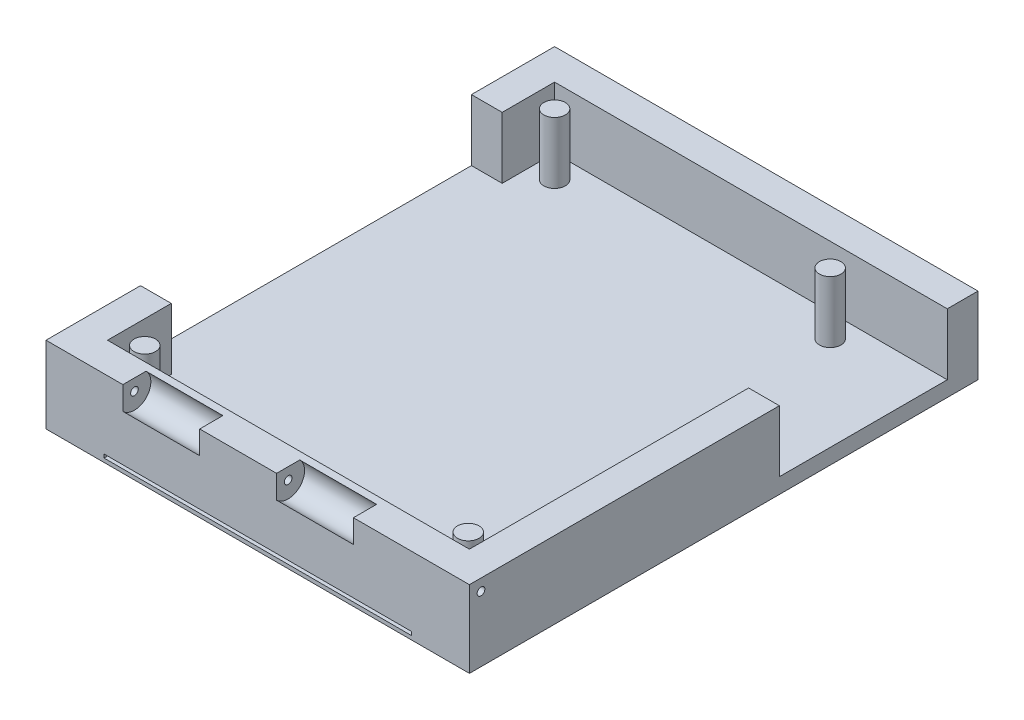
from build123d import *

# Parameters (mm, degrees)
SKETCH1_W           = 47.09
SKETCH1_H           = 58.17
BOSS_EXTRUDE1_DEPTH = 2
SKETCH2_R           = 1.4
BOSS_EXTRUDE2_DEPTH = 8
BOSS_EXTRUDE3_DEPTH = 10
SKETCH6_W           = 4.055357108
SKETCH6_H           = 43.053811849
SKETCH6_W_2         = 4
SKETCH6_H_2         = 21.843851608
CUT_EXTRUDE2_DEPTH  = 8
SKETCH8_R           = 0.5
CUT_EXTRUDE3_DEPTH  = 84.666104248
SKETCH10_R          = 2.134407384
CUT_EXTRUDE4_DEPTH  = 10
SKETCH11_R          = 2.134407384
CUT_EXTRUDE5_DEPTH  = 10
BOSS_EXTRUDE4_DEPTH = 2
SKETCH13_W          = 39.99
SKETCH13_H          = 0.463806664
CUT_EXTRUDE6_DEPTH  = 85.194162505


with BuildPart() as part:
    # Sketch1 → Boss-Extrude1 (new body)
    with BuildSketch(Plane(origin=(0, 0, 0), x_dir=(1, 0, 0), z_dir=(0, 1, 0))):
        with Locations((23.545, -29.085)):
            Rectangle(SKETCH1_W, SKETCH1_H)
    extrude(amount=BOSS_EXTRUDE1_DEPTH)

    # Sketch2 → Boss-Extrude2 (add)
    with BuildSketch(Plane(origin=(0, 2, 0), x_dir=(1, 0, 0), z_dir=(0, 1, 0))):
        with Locations(Location((38.86, -3, 0), (0, 0, 90))):
            Circle(SKETCH2_R)
        with Locations(Location((45.09, -56.32, 0), (0, 0, 90))):
            Circle(SKETCH2_R)
        with Locations(Location((3, -56.32, 0), (0, 0, 90))):
            Circle(SKETCH2_R)
        with Locations(Location((3, -3, 0), (0, 0, 90))):
            Circle(SKETCH2_R)
    extrude(amount=BOSS_EXTRUDE2_DEPTH)

    # Sketch3 → Boss-Extrude3 (add)
    with BuildSketch(Plane(origin=(0, 0, 0), x_dir=(1, 0, 0), z_dir=(0, 1, 0))):
        Polygon((0, -26.469922438), (0, 0), (23.66505447, 0), (23.66505447, 4), (-4, 4), (-4, -26.469922438), align=None)
        Polygon((23.66505447, 4), (23.66505447, 0), (47.09, 0), (47.09, -29.085), (51.09, -29.085), (51.09, 4), align=None)
        Polygon((47.09, -58.17), (23.66505447, -58.17), (23.66505447, -62.17), (51.09, -62.17), (51.09, -29.085), (47.09, -29.085), align=None)
        Polygon((0, -58.17), (0, -26.469922438), (-4, -26.469922438), (-4, -62.17), (23.66505447, -62.17), (23.66505447, -58.17), align=None)
    extrude(amount=BOSS_EXTRUDE3_DEPTH)

    # Sketch6 → Cut-Extrude2 (cut)
    with BuildSketch(Plane(origin=(0, 10, 0), x_dir=(1, 0, 0), z_dir=(0, 1, 0))):
        with Locations((-1.972321446, -28.345718343)):
            Rectangle(SKETCH6_W, SKETCH6_H)
        with Locations((49.09, -10.921925804)):
            Rectangle(SKETCH6_W_2, SKETCH6_H_2)
    extrude(amount=-CUT_EXTRUDE2_DEPTH, mode=Mode.SUBTRACT)

    # Sketch8 → Cut-Extrude3 (cut, through all)
    with BuildSketch(Plane(origin=(51.09, 0, 0), x_dir=(0, 0, -1), z_dir=(1, 0, 0))):
        with Locations((-60.66237095, 8.489122927)):
            Circle(SKETCH8_R)
    extrude(amount=-CUT_EXTRUDE3_DEPTH, mode=Mode.SUBTRACT)

    # Sketch10 → Cut-Extrude4 (cut)
    with BuildSketch(Plane(origin=(6, 10, 62.17), x_dir=(0, 0, -1), z_dir=(1, 0, 0))):
        with Locations((1.50762905, -1.510877073)):
            Circle(SKETCH10_R)
    extrude(amount=CUT_EXTRUDE4_DEPTH, mode=Mode.SUBTRACT)

    # Sketch11 → Cut-Extrude5 (cut)
    with BuildSketch(Plane(origin=(26, 10, 62.17), x_dir=(0, 0, -1), z_dir=(1, 0, 0))):
        with Locations((1.50762905, -1.510877073)):
            Circle(SKETCH11_R)
    extrude(amount=CUT_EXTRUDE5_DEPTH, mode=Mode.SUBTRACT)

    # Sketch12 → Boss-Extrude4 (add)
    with BuildSketch(Plane(origin=(0, 0, -4), x_dir=(-1, 0, 0), z_dir=(0, 0, -1))):
        Polygon((-23.54, 7.513197032), (-28.54, 7.513197032), (-28.54, 6.476270602), (-18.54, 6.476270602), (-18.54, 7.513197032), align=None)
    extrude(amount=BOSS_EXTRUDE4_DEPTH)

    # Sketch13 → Cut-Extrude6 (cut, through all)
    with BuildSketch(Plane(origin=(0, 0, -4), x_dir=(-1, 0, 0), z_dir=(0, 0, -1))):
        with Locations((-23.545, 0.728666672)):
            Rectangle(SKETCH13_W, SKETCH13_H)
    extrude(amount=-CUT_EXTRUDE6_DEPTH, mode=Mode.SUBTRACT)


solid = part.part
